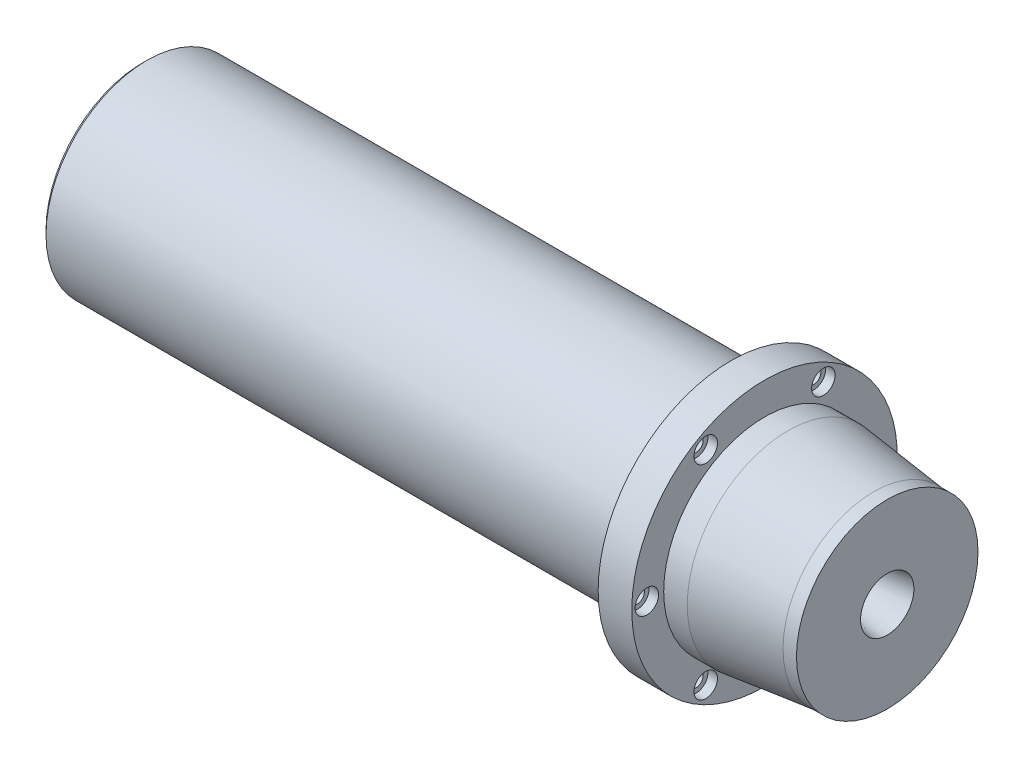
from build123d import *

# Parameters (mm, degrees)
CHAMFER1_SIZE                           = 2.5
CBORE_FOR_M8_HEX_HEAD_BOLT2_D           = 8.4
CBORE_FOR_M8_HEX_HEAD_BOLT2_CBORE_D     = 14
CBORE_FOR_M8_HEX_HEAD_BOLT2_CBORE_DEPTH = 5.68


with BuildPart() as part:
    # Sketch1 → Revolve1 (revolve)
    with BuildSketch(Plane(origin=(0, 0, 0), x_dir=(1, 0, 0), z_dir=(0, 1, 0)), mode=Mode.PRIVATE) as revolve1_sk:
        Polygon((0, 0), (0, 60), (350, 60), (350, 79), (370, 79), (370, 60), (384, 60), (435, 54), (443, 54), (443, 15.875), (394.6, 8.8165), (382.6, 8.8165), (382.6, 0), align=None)
    revolve(revolve1_sk.sketch.rotate(Axis((0, 0, 0), (1, 0, 0)), 180), axis=Axis((0, 0, 0), (1, 0, 0)))

    # Chamfer1
    chamfer1_edges = [part.edges().sort_by_distance(p)[0] for p in [
        (0, 0, -60),
    ]]
    chamfer(chamfer1_edges, length=CHAMFER1_SIZE)

    # CBORE for M8 Hex Head Bolt2 (through all)
    with Locations(Plane(origin=(370, 0, 0), x_dir=(0, 0, -1), z_dir=(1, 0, 0))):
        with Locations((-70, 0), (-35, 60.621778265), (35, 60.621778265), (70, 0), (35, -60.621778265), (-35, -60.621778265)):
            CounterBoreHole(CBORE_FOR_M8_HEX_HEAD_BOLT2_D / 2, CBORE_FOR_M8_HEX_HEAD_BOLT2_CBORE_D / 2, CBORE_FOR_M8_HEX_HEAD_BOLT2_CBORE_DEPTH)


solid = part.part
